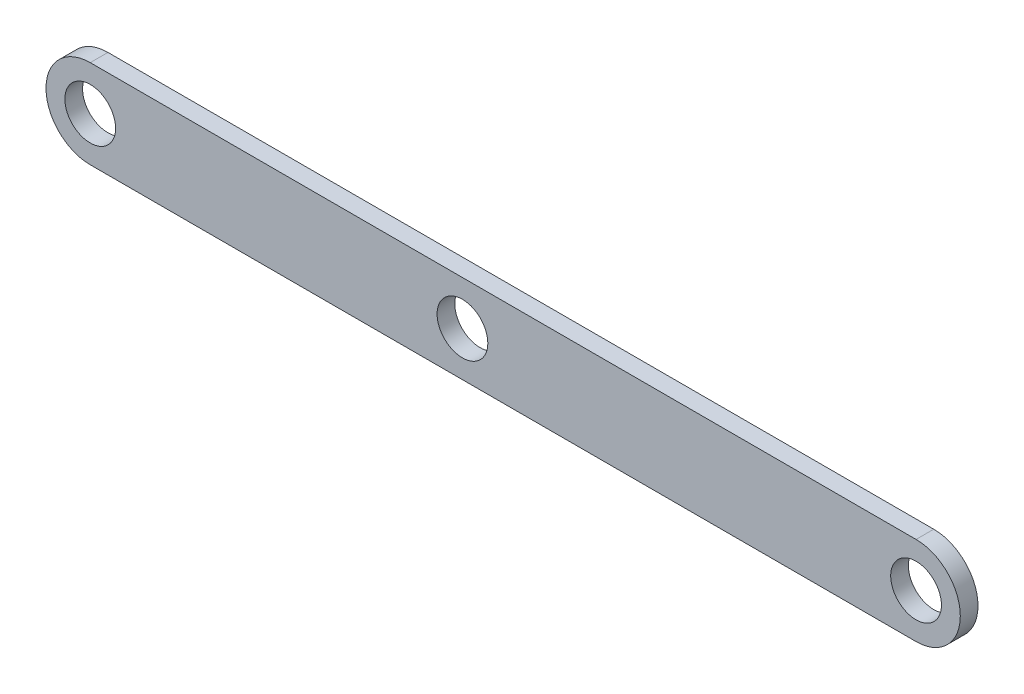
from build123d import *

# Parameters (mm, degrees)
BOSS_EXTRUDE1_DEPTH = 3
SKETCH2_R           = 4.3
CUT_EXTRUDE1_DEPTH  = 148.721020847


with BuildPart() as part:
    # Sketch1 → Boss-Extrude1 (new body)
    with BuildSketch(Plane.XY):
        with BuildLine():
            Line((0, 7.5), (140, 7.5))
            ThreePointArc((140, 7.5), (147.5, 0), (140, -7.5))
            Line((140, -7.5), (0, -7.5))
            ThreePointArc((0, -7.5), (-7.5, 0), (0, 7.5))
        make_face()
    extrude(amount=BOSS_EXTRUDE1_DEPTH)

    # Sketch2 → Cut-Extrude1 (cut, through all)
    with BuildSketch(Plane.XY.offset(3)):
        Circle(SKETCH2_R)
        with Locations((140, 0)):
            Circle(SKETCH2_R)
        with Locations((63.1, 0)):
            Circle(SKETCH2_R)
    extrude(amount=-CUT_EXTRUDE1_DEPTH, mode=Mode.SUBTRACT)


solid = part.part
